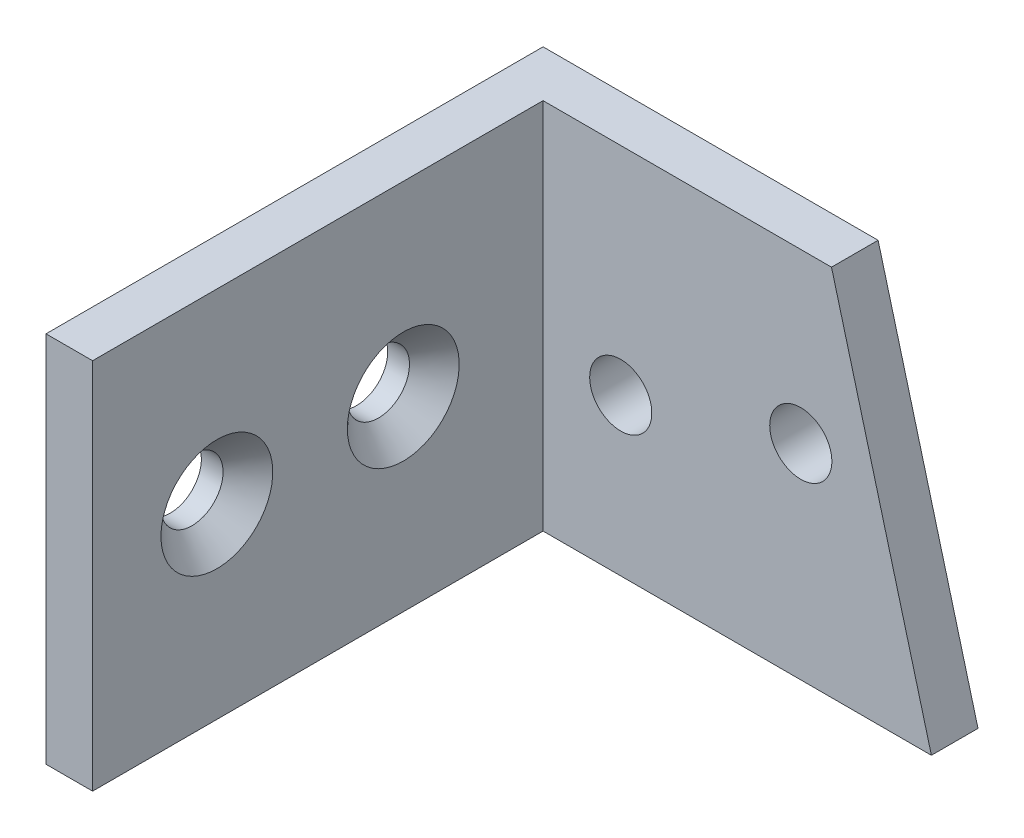
from build123d import *

# Parameters (mm, degrees)
BOSS_EXTRUDE1_DEPTH     = 38.1
SKETCH2_R               = 3.175
CUT_EXTRUDE1_DEPTH      = 38.1
CUT_EXTRUDE3_REACH      = 79.512
SKETCH3_R               = 3.175
CUT_EXTRUDE4_DEPTH      = 75.882225236
CUT_EXTRUDE4_DEPTH_BACK = 75.882225236
CHAMFER1_SIZE           = 2.54


with BuildPart() as part:
    # Sketch1 → Boss-Extrude1 (new body)
    with BuildSketch(Plane(origin=(0, 0, 0), x_dir=(1, 0, 0), z_dir=(0, 1, 0))):
        Polygon((0, 0), (0, 46.0375), (39.6875, 46.0375), (39.6875, 50.8), (-4.7625, 50.8), (-4.7625, 0), align=None)
    extrude(amount=BOSS_EXTRUDE1_DEPTH)

    # Sketch2 → Cut-Extrude1 (cut)
    with BuildSketch(Plane(origin=(0, 0, -50.8), x_dir=(-1, 0, 0), z_dir=(0, 0, -1))):
        with Locations((-26.338386991, 20.92691832)):
            Circle(SKETCH2_R)
        with Locations((-7.9375, 15.996415511)):
            Circle(SKETCH2_R)
    extrude(amount=-CUT_EXTRUDE1_DEPTH, mode=Mode.SUBTRACT)

    # Sketch3 → Cut-Extrude3 (cut, up to next)
    with BuildSketch(Plane.ZY.offset(4.7625), mode=Mode.PRIVATE) as cut_extrude3_sk1:
        with Locations((-12.7, 19.05)):
            Circle(SKETCH3_R)
    cut_extrude3_tool1 = extrude(cut_extrude3_sk1.sketch, amount=-CUT_EXTRUDE3_REACH, mode=Mode.PRIVATE) & part.part
    # Sketch3 → Cut-Extrude3 (cut, up to next)
    with BuildSketch(Plane.ZY.offset(4.7625), mode=Mode.PRIVATE) as cut_extrude3_sk2:
        with Locations((-31.75, 19.05)):
            Circle(SKETCH3_R)
    cut_extrude3_tool2 = extrude(cut_extrude3_sk2.sketch, amount=-CUT_EXTRUDE3_REACH, mode=Mode.PRIVATE) & part.part
    add(cut_extrude3_tool1.solids().sort_by_distance((-4.7625, 19.05, -12.7))[0], mode=Mode.SUBTRACT)
    add(cut_extrude3_tool2.solids().sort_by_distance((-4.7625, 19.05, -31.75))[0], mode=Mode.SUBTRACT)

    # Sketch4 → Cut-Extrude4 (cut, two sides: drawn at the far end of the back side and taken through both)
    with BuildSketch(Plane(origin=(0, 0, -50.8), x_dir=(-1, 0, 0), z_dir=(0, 0, -1)).offset(-CUT_EXTRUDE4_DEPTH_BACK)):
        Polygon((3.41421458, 160.857788706), (-29.478635768, 38.1), (-39.6875, 0), (-72.580350349, -122.757788706), (-318.095927761, -56.972088009), (-242.101362833, 226.643489404), align=None)
    extrude(amount=CUT_EXTRUDE4_DEPTH + CUT_EXTRUDE4_DEPTH_BACK, mode=Mode.SUBTRACT)

    # Chamfer1
    chamfer1_edges = [part.edges().sort_by_distance(p)[0] for p in [
        (0, 19.05, -15.875),
        (0, 19.05, -34.925),
    ]]
    chamfer(chamfer1_edges, length=CHAMFER1_SIZE)


solid = part.part
